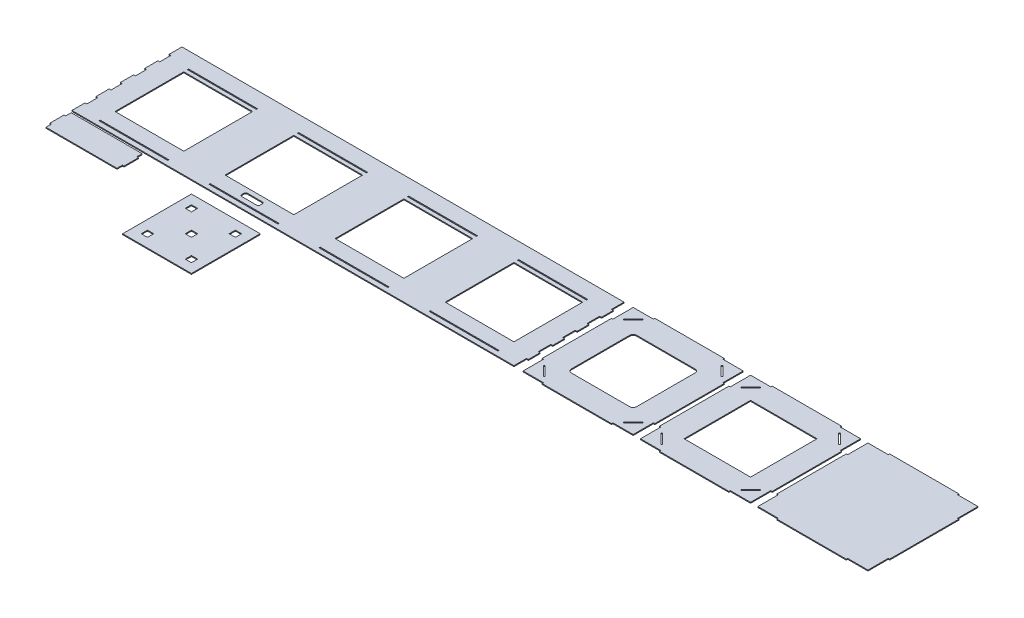
from build123d import *

# Parameters (mm, degrees)
BOSS_EXTRUDE1_DEPTH   = 2.54
SKETCH5_W             = 190.5
SKETCH5_H             = 3.302
SKETCH5_H_2           = 190.5
CUT_EXTRUDE2_DEPTH    = 783.076682941
BOSS_EXTRUDE2_DEPTH   = 2.54
SKETCH6_W             = 184.15
SKETCH6_H             = 184.15
BOSS_EXTRUDE2_2_DEPTH = 2.54
BOSS_EXTRUDE2_3_DEPTH = 2.54
BOSS_EXTRUDE3_DEPTH   = 2.54
CUT_EXTRUDE3_DEPTH    = 1460.466516951
SKETCH9_W             = 190.5
SKETCH9_H             = 190.5
SKETCH9_W_2           = 17.272
SKETCH9_H_2           = 17.272
BOSS_EXTRUDE4_DEPTH   = 2.54
CUT_EXTRUDE4_DEPTH    = 1491.143958147


with BuildPart() as part:
    # Sketch1 → Boss-Extrude1 (new body)
    with BuildSketch(Plane(origin=(0, 0, 0), x_dir=(1, 0, 0), z_dir=(0, 1, 0))):
        Polygon((152.4, 152.4), (457.2, 152.4), (457.2, 117.5512), (462.28, 117.5512), (462.28, 84.9122), (457.2, 84.9122), (457.2, 50.0634), (462.28, 50.0634), (462.28, 17.4244), (457.2, 17.4244), (457.2, -17.4244), (462.28, -17.4244), (462.28, -50.0634), (457.2, -50.0634), (457.2, -84.9122), (462.28, -84.9122), (462.28, -117.5512), (457.2, -117.5512), (457.2, -152.4), (152.4, -152.4), (-152.4, -152.4), (-457.2, -152.4), (-762, -152.4), (-767.08, -152.4), (-767.08, -116.4717), (-762, -116.4717), (-762, -85.9917), (-767.08, -85.9917), (-767.08, -48.9839), (-762, -48.9839), (-762, -18.5039), (-767.08, -18.5039), (-767.08, 18.5039), (-762, 18.5039), (-762, 48.9839), (-767.08, 48.9839), (-767.08, 85.9917), (-762, 85.9917), (-762, 116.4717), (-767.08, 116.4717), (-767.08, 152.4), (-762, 152.4), (-457.2, 152.4), (-152.4, 152.4), align=None)
    extrude(amount=BOSS_EXTRUDE1_DEPTH)

    # Sketch5 → Cut-Extrude2 (cut, through all)
    with BuildSketch(Plane(origin=(0, 2.54, 0), x_dir=(1, 0, 0), z_dir=(0, 1, 0))):
        with Locations((-609.6, -138.049)):
            Rectangle(SKETCH5_W, SKETCH5_H)
        with Locations((-304.8, -138.049)):
            Rectangle(SKETCH5_W, SKETCH5_H)
        with Locations((0, -138.049)):
            Rectangle(SKETCH5_W, SKETCH5_H)
        with Locations((304.8, -138.049)):
            Rectangle(SKETCH5_W, SKETCH5_H)
        with Locations((-609.6, 0)):
            Rectangle(SKETCH5_W, SKETCH5_H_2)
        with Locations((-304.8, 0)):
            Rectangle(SKETCH5_W, SKETCH5_H_2)
        Rectangle(SKETCH5_W, SKETCH5_H_2)
        with Locations((304.8, 0)):
            Rectangle(SKETCH5_W, SKETCH5_H_2)
        with Locations((-609.6, 107.061)):
            Rectangle(SKETCH5_W, SKETCH5_H)
        with Locations((-304.8, 107.061)):
            Rectangle(SKETCH5_W, SKETCH5_H)
        with Locations((0, 107.061)):
            Rectangle(SKETCH5_W, SKETCH5_H)
        with Locations((304.8, 107.061)):
            Rectangle(SKETCH5_W, SKETCH5_H)
        with BuildLine():
            Line((-325.12, -107.95), (-284.48, -107.95))
            ThreePointArc((-284.48, -107.95), (-280.887897552, -109.437897552), (-279.4, -113.03))
            Line((-279.4, -113.03), (-279.4, -118.618))
            ThreePointArc((-279.4, -118.618), (-280.887897552, -122.210102448), (-284.48, -123.698))
            Line((-284.48, -123.698), (-325.12, -123.698))
            ThreePointArc((-325.12, -123.698), (-328.712102448, -122.210102448), (-330.2, -118.618))
            Line((-330.2, -118.618), (-330.2, -113.03))
            ThreePointArc((-330.2, -113.03), (-328.712102448, -109.437897552), (-325.12, -107.95))
        make_face()
    extrude(amount=-CUT_EXTRUDE2_DEPTH, mode=Mode.SUBTRACT)


with BuildPart() as body_2:
    # Sketch6 → Boss-Extrude2 (new body)
    with BuildSketch(Plane(origin=(0, 0, 0), x_dir=(1, 0, 0), z_dir=(0, 1, 0))):
        Polygon((482.6, 96.139), (482.6, 152.4), (538.861, 152.4), (538.861, 156.21), (731.139, 156.21), (731.139, 152.4), (787.4, 152.4), (787.4, 96.139), (791.21, 96.139), (791.21, -96.139), (787.4, -96.139), (787.4, -152.4), (731.139, -152.4), (731.139, -156.21), (538.861, -156.21), (538.861, -152.4), (482.6, -152.4), (482.6, -96.139), (478.79, -96.139), (478.79, 96.139), align=None)
    extrude(amount=BOSS_EXTRUDE2_DEPTH)


with BuildPart() as body_3:
    # Sketch6 → Boss-Extrude2 2 (new body)
    with BuildSketch(Plane(origin=(0, 0, 0), x_dir=(1, 0, 0), z_dir=(0, 1, 0))):
        Polygon((803.91, 96.139), (803.91, -96.139), (807.72, -96.139), (807.72, -152.4), (863.981, -152.4), (863.981, -156.21), (1056.259, -156.21), (1056.259, -152.4), (1112.52, -152.4), (1112.52, -96.139), (1116.33, -96.139), (1116.33, 96.139), (1112.52, 96.139), (1112.52, 152.4), (1056.259, 152.4), (1056.259, 156.21), (863.981, 156.21), (863.981, 152.4), (807.72, 152.4), (807.72, 96.139), align=None)
        with Locations((960.12, 0)):
            Rectangle(SKETCH6_W, SKETCH6_H, mode=Mode.SUBTRACT)
    extrude(amount=BOSS_EXTRUDE2_2_DEPTH)


with BuildPart() as body_4:
    # Sketch6 → Boss-Extrude2 3 (new body)
    with BuildSketch(Plane(origin=(0, 0, 0), x_dir=(1, 0, 0), z_dir=(0, 1, 0))):
        Polygon((1129.03, 96.139), (1129.03, -96.139), (1132.84, -96.139), (1132.84, -152.4), (1189.101, -152.4), (1189.101, -156.21), (1381.379, -156.21), (1381.379, -152.4), (1437.64, -152.4), (1437.64, -96.139), (1441.45, -96.139), (1441.45, 96.139), (1437.64, 96.139), (1437.64, 152.4), (1381.379, 152.4), (1381.379, 156.21), (1189.101, 156.21), (1189.101, 152.4), (1132.84, 152.4), (1132.84, 96.139), align=None)
    extrude(amount=BOSS_EXTRUDE2_3_DEPTH)


with BuildPart() as body_5:
    # Sketch7 → Boss-Extrude3 (new body)
    with BuildSketch(Plane(origin=(0, 0, 0), x_dir=(1, 0, 0), z_dir=(0, 1, 0))):
        Polygon((-762.635, -158.75), (-566.039, -158.75), (-566.039, -173.99), (-561.594, -173.99), (-561.594, -213.36), (-566.039, -213.36), (-566.039, -228.6), (-762.635, -228.6), (-762.635, -213.36), (-767.08, -213.36), (-767.08, -173.99), (-762.635, -173.99), align=None)
    extrude(amount=BOSS_EXTRUDE3_DEPTH)


with BuildPart() as cut_extrude3_tool:
    # Sketch8 → Cut-Extrude3 (new, through all)
    with BuildSketch(Plane(origin=(0, 2.54, 0), x_dir=(1, 0, 0), z_dir=(0, 1, 0))):
        Polygon((497.260115818, -110.799115818), (524.200884182, -137.739884182), (526.535750773, -135.40501759), (499.59498241, -108.464249227), align=None)
        Polygon((526.535750773, 135.40501759), (499.59498241, 108.464249227), (497.260115818, 110.799115818), (524.200884182, 137.739884182), align=None)
        Polygon((770.40501759, 108.464249227), (743.464249227, 135.40501759), (745.799115818, 137.739884182), (772.739884182, 110.799115818), align=None)
        Polygon((743.464249227, -135.40501759), (770.40501759, -108.464249227), (772.739884182, -110.799115818), (745.799115818, -137.739884182), align=None)
        Polygon((822.380115818, -110.799115818), (824.71498241, -108.464249227), (851.655750773, -135.40501759), (849.320884182, -137.739884182), align=None)
        Polygon((824.71498241, 108.464249227), (822.380115818, 110.799115818), (849.320884182, 137.739884182), (851.655750773, 135.40501759), align=None)
        Polygon((1068.584249227, 135.40501759), (1070.919115818, 137.739884182), (1097.859884182, 110.799115818), (1095.52501759, 108.464249227), align=None)
        Polygon((1095.52501759, -108.464249227), (1097.859884182, -110.799115818), (1070.919115818, -137.739884182), (1068.584249227, -135.40501759), align=None)
    extrude(amount=-CUT_EXTRUDE3_DEPTH)


with BuildPart() as body_2_1:
    add(body_2.part)

    # Cut-Extrude3: cut by cut_extrude3_tool
    add(cut_extrude3_tool.part, mode=Mode.SUBTRACT)

    # Sketch14 → Cut-Extrude4 (cut, through all)
    with BuildSketch(Plane(origin=(0, 2.54, 0), x_dir=(1, 0, 0), z_dir=(0, 1, 0))):
        with BuildLine():
            Line((554.0375, 90.4875), (715.9625, 90.4875))
            ThreePointArc((715.9625, 90.4875), (722.697692091, 87.697692091), (725.4875, 80.9625))
            Line((725.4875, 80.9625), (725.4875, -80.9625))
            ThreePointArc((725.4875, -80.9625), (722.697692091, -87.697692091), (715.9625, -90.4875))
            Line((715.9625, -90.4875), (554.0375, -90.4875))
            ThreePointArc((554.0375, -90.4875), (547.302307909, -87.697692091), (544.5125, -80.9625))
            Line((544.5125, -80.9625), (544.5125, 80.9625))
            ThreePointArc((544.5125, 80.9625), (547.302307909, 87.697692091), (554.0375, 90.4875))
        make_face()
    extrude(amount=-CUT_EXTRUDE4_DEPTH, mode=Mode.SUBTRACT)


with BuildPart() as body_3_1:
    add(body_3.part)

    # Cut-Extrude3: cut by cut_extrude3_tool
    add(cut_extrude3_tool.part, mode=Mode.SUBTRACT)


with BuildPart() as body_6:
    # Sketch9 → Boss-Extrude4 (new body)
    with BuildSketch(Plane(origin=(0, 0, 0), x_dir=(1, 0, 0), z_dir=(0, 1, 0))):
        with Locations((-305.858842058, -282.565380711)):
            Rectangle(SKETCH9_W, SKETCH9_H)
        with Locations((-305.858842058, -282.565380711)):
            Rectangle(SKETCH9_W_2, SKETCH9_H_2, mode=Mode.SUBTRACT)
        with Locations((-366.757569252, -221.666653517)):
            Rectangle(SKETCH9_W_2, SKETCH9_H_2, mode=Mode.SUBTRACT)
        with Locations((-366.757569252, -343.464107904)):
            Rectangle(SKETCH9_W_2, SKETCH9_H_2, mode=Mode.SUBTRACT)
        with Locations((-244.960114864, -343.464107904)):
            Rectangle(SKETCH9_W_2, SKETCH9_H_2, mode=Mode.SUBTRACT)
        with Locations((-244.960114864, -221.666653517)):
            Rectangle(SKETCH9_W_2, SKETCH9_H_2, mode=Mode.SUBTRACT)
    extrude(amount=BOSS_EXTRUDE4_DEPTH)


solid = Compound([part.part, body_4.part, body_5.part, body_2_1.part, body_3_1.part, body_6.part])
